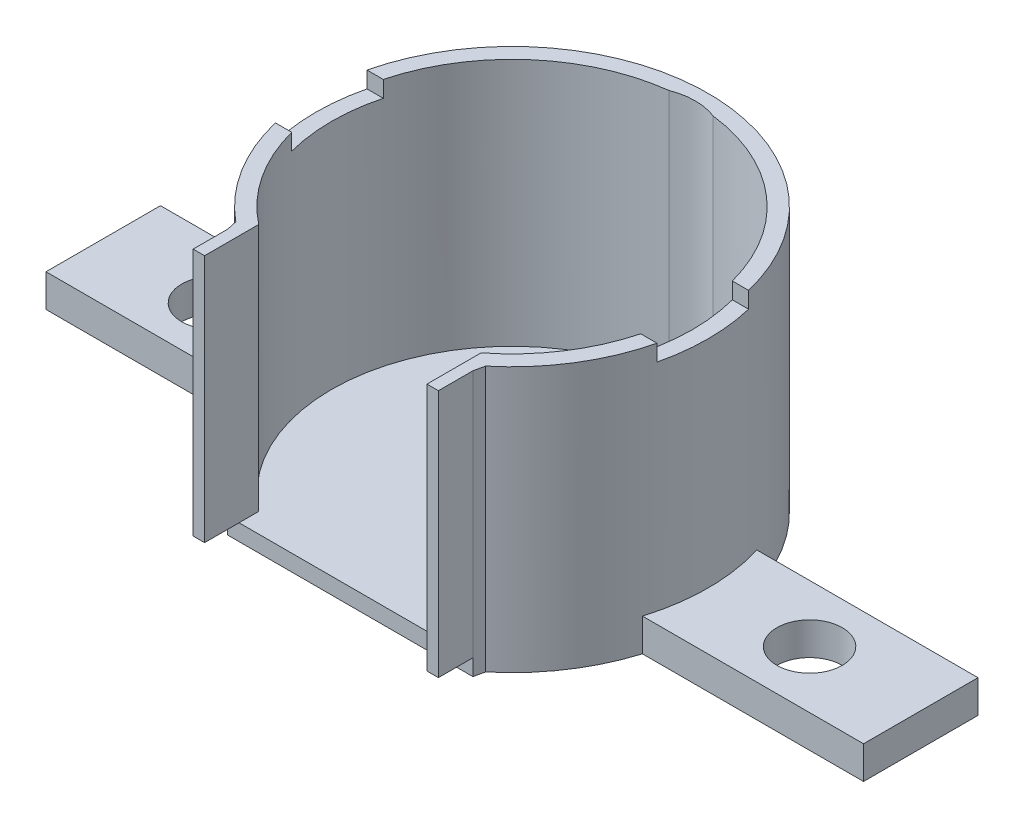
from build123d import *

# Parameters (mm, degrees)
SKETCH1_R           = 15.24
SKETCH1_R_2         = 14.01445
BOSS_EXTRUDE1_DEPTH = 19.304
SKETCH2_R           = 14.01445
CUT_EXTRUDE1_DEPTH  = 29.934204707
CUT_EXTRUDE2_DEPTH  = 29.934204707
BOSS_EXTRUDE2_START = 1.27
BOSS_EXTRUDE2_DEPTH = 1.27
SKETCH6_R           = 4.699
CUT_EXTRUDE3_DEPTH  = 29.934204707
SKETCH8_W           = 17.272
SKETCH8_H           = 8.89
SKETCH8_R           = 2.54
BOSS_EXTRUDE3_DEPTH = 2.54
SKETCH9_W           = 2.159
SKETCH9_H           = 7.112
CUT_EXTRUDE4_DEPTH  = 1.27


with BuildPart() as part:
    # Sketch1 → Boss-Extrude1 (new body)
    # profile 1 of 2: a face of its own
    with BuildSketch(Plane(origin=(0, 0, 0), x_dir=(1, 0, 0), z_dir=(0, 1, 0))):
        Circle(SKETCH1_R)
        Circle(SKETCH1_R_2, mode=Mode.SUBTRACT)
    # profile 2 of 2: a face of its own
    with BuildSketch(Plane(origin=(0, 0, 0), x_dir=(1, 0, 0), z_dir=(0, 1, 0))):
        Polygon((-9.525, -12.563180017), (-10.16, -9.652937833), (10.16, -9.652937833), (9.525, -12.563180017), (9.525, -15.240937833), (-9.525, -15.240937833), align=None)
    extrude(amount=BOSS_EXTRUDE1_DEPTH)

    # Sketch2 → Cut-Extrude1 (cut, through all)
    with BuildSketch(Plane(origin=(0, 19.304, 0), x_dir=(1, 0, 0), z_dir=(0, 1, 0))):
        Circle(SKETCH2_R)
    extrude(amount=-CUT_EXTRUDE1_DEPTH, mode=Mode.SUBTRACT)

    # Sketch3 → Cut-Extrude2 (cut, through all)
    with BuildSketch(Plane(origin=(0, 19.304, 0), x_dir=(1, 0, 0), z_dir=(0, 1, 0))):
        with BuildLine():
            Line((-8.636, -14.01445), (-8.636, -15.240937833))
            Line((-8.636, -15.240937833), (8.636, -15.240937833))
            Line((8.636, -15.240937833), (8.636, -14.01445))
            Line((8.636, -14.01445), (8.636, -11.037405166))
            ThreePointArc((8.636, -11.037405166), (0, -14.01445), (-8.636, -11.037405166))
            Line((-8.636, -11.037405166), (-8.636, -14.01445))
        make_face()
    extrude(amount=-CUT_EXTRUDE2_DEPTH, mode=Mode.SUBTRACT)

    # Sketch4 → Boss-Extrude2 (add)
    with BuildSketch(Plane.XZ.offset(BOSS_EXTRUDE2_START)):
        with BuildLine():
            Line((9.525, 12.563180017), (9.701775888, 11.753005769))
            ThreePointArc((9.701775888, 11.753005769), (0, -15.24), (-9.701775888, 11.753005769))
            Line((-9.701775888, 11.753005769), (-9.525, 12.563180017))
            Line((-9.525, 12.563180017), (9.525, 12.563180017))
        make_face()
    extrude(amount=-BOSS_EXTRUDE2_DEPTH)

    # Sketch6 → Cut-Extrude3 (cut, through all)
    with BuildSketch(Plane.XZ):
        with Locations((0, -9.534819983)):
            Circle(SKETCH6_R)
    extrude(amount=-CUT_EXTRUDE3_DEPTH, mode=Mode.SUBTRACT)

    # Sketch8 → Boss-Extrude3 (add)
    # profile 1 of 2: a face of its own
    with BuildSketch(Plane.XZ.offset(1.27)):
        with Locations((23.114, 0)):
            Rectangle(SKETCH8_W, SKETCH8_H)
        with Locations((23.114, 0)):
            Circle(SKETCH8_R, mode=Mode.SUBTRACT)
    # profile 2 of 2: a face of its own
    with BuildSketch(Plane.XZ.offset(1.27)):
        with Locations((-23.114, 0)):
            Rectangle(SKETCH8_W, SKETCH8_H)
        with Locations((-23.114, 0)):
            Circle(SKETCH8_R, mode=Mode.SUBTRACT)
    extrude(amount=-BOSS_EXTRUDE3_DEPTH)

    # Sketch9 → Cut-Extrude4 (cut)
    with BuildSketch(Plane(origin=(0, 19.304, 0), x_dir=(1, 0, 0), z_dir=(0, 1, 0))):
        with Locations((14.605, 0)):
            Rectangle(SKETCH9_W, SKETCH9_H)
        with Locations((-14.605, 0)):
            Rectangle(SKETCH9_W, SKETCH9_H)
    extrude(amount=-CUT_EXTRUDE4_DEPTH, mode=Mode.SUBTRACT)


solid = part.part
